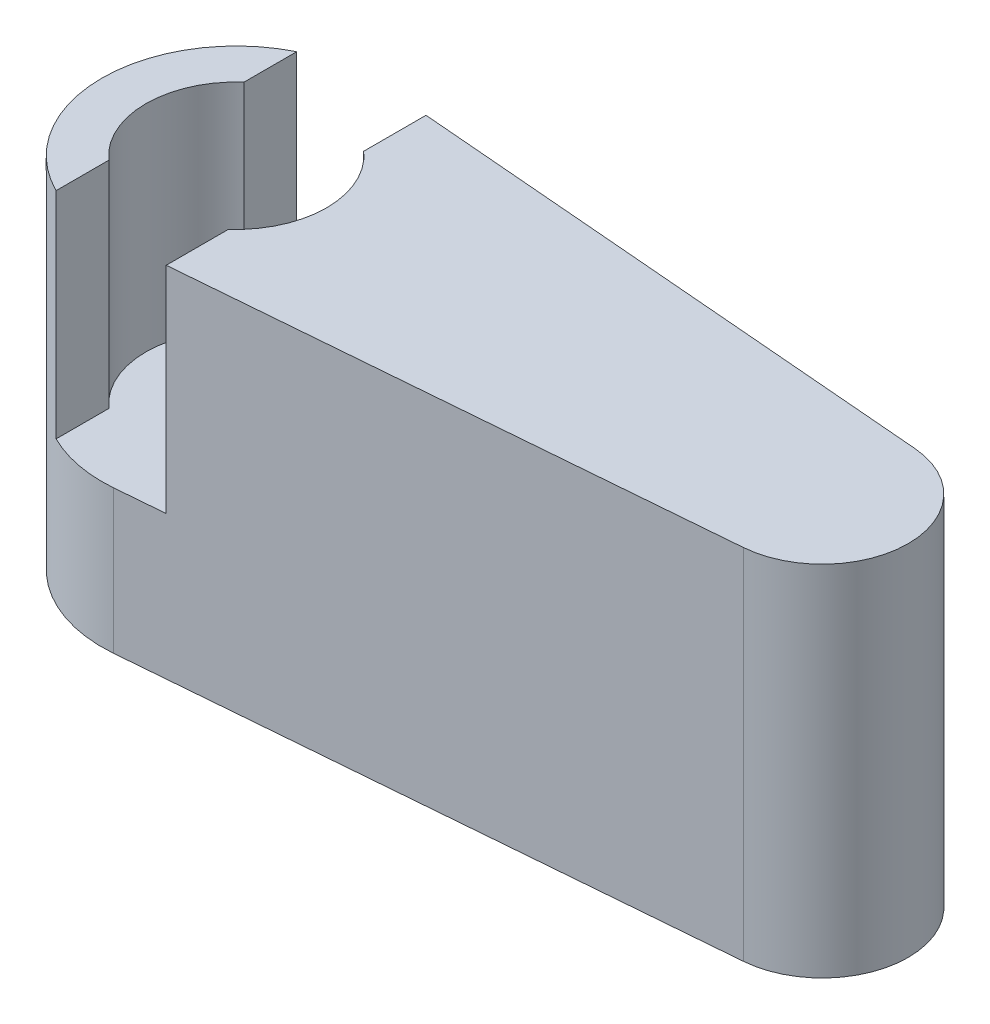
from build123d import *

# Parameters (mm, degrees)
BOSS_EXTRUDE1_DEPTH = 10
CUT_EXTRUDE1_DEPTH  = 6


with BuildPart() as part:
    # Sketch1 → Boss-Extrude1 (new body)
    with BuildSketch(Plane(origin=(0, 0, 0), x_dir=(1, 0, 0), z_dir=(0, 1, 0))):
        with BuildLine():
            Line((0.309633028, -3.737195123), (16.548165138, -2.391804879))
            ThreePointArc((16.548165138, -2.391804879), (18.75, 0), (16.548165138, 2.391804879))
            Line((16.548165138, 2.391804879), (0.309633028, 3.737195123))
            ThreePointArc((0.309633028, 3.737195123), (-3.75, 0), (0.309633028, -3.737195123))
        make_face()
    extrude(amount=BOSS_EXTRUDE1_DEPTH)

    # Sketch2 → Cut-Extrude1 (cut)
    with BuildSketch(Plane(origin=(0, 10, 0), x_dir=(1, 0, 0), z_dir=(0, 1, 0))):
        with BuildLine():
            Line((-1.67, -1.887193684), (-1.67, -5.52))
            Line((-1.67, -5.52), (1.67, -5.52))
            Line((1.67, -5.52), (1.67, -1.887193684))
            ThreePointArc((1.67, -1.887193684), (2.52, 0), (1.67, 1.887193684))
            Line((1.67, 1.887193684), (1.67, 5.52))
            Line((1.67, 5.52), (-1.67, 5.52))
            Line((-1.67, 5.52), (-1.67, 1.887193684))
            ThreePointArc((-1.67, 1.887193684), (-2.52, 0), (-1.67, -1.887193684))
        make_face()
    extrude(amount=-CUT_EXTRUDE1_DEPTH, mode=Mode.SUBTRACT)


solid = part.part
